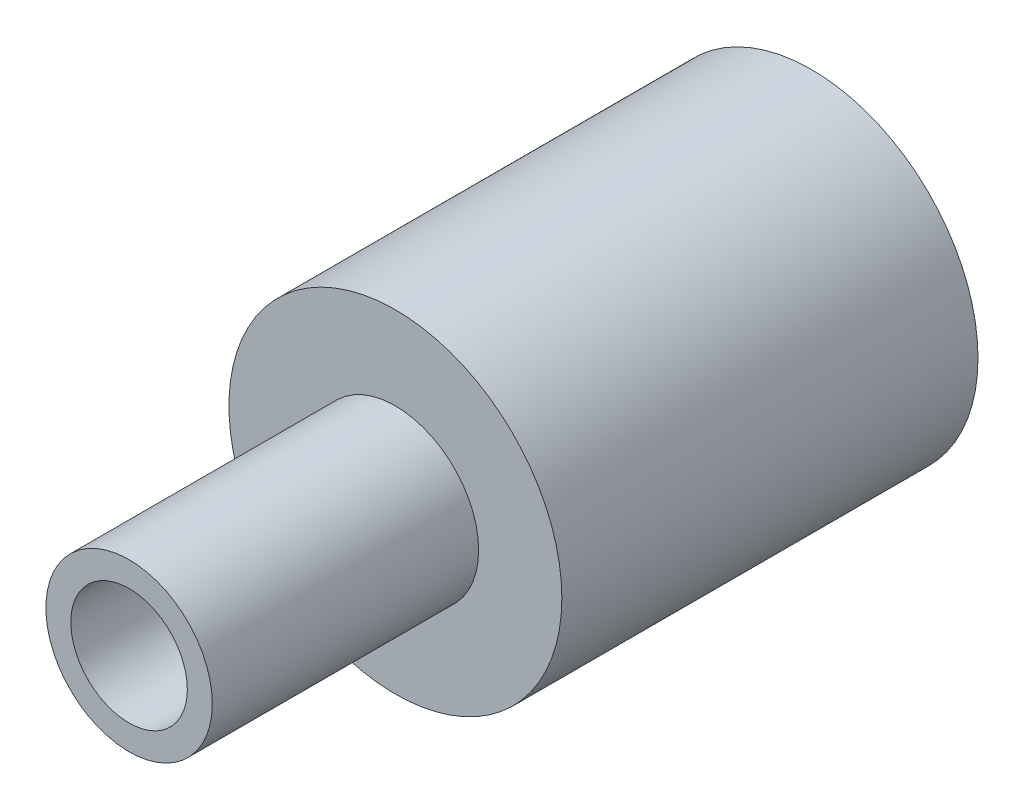
from build123d import *

# Parameters (mm, degrees)
SKETCH1_R           = 10
BOSS_EXTRUDE1_DEPTH = 41
SKETCH2_R           = 5
CUT_EXTRUDE1_DEPTH  = 10
SKETCH3_OUTSIDE_W   = 31.962
SKETCH3_OUTSIDE_H   = 31.962
SKETCH3_OUTSIDE_R   = 5
CUT_EXTRUDE2_DEPTH  = 16
SKETCH4_R           = 3.5
CUT_EXTRUDE3_DEPTH  = 12


with BuildPart() as part:
    # Sketch1 → Boss-Extrude1 (new body)
    with BuildSketch(Plane.XY):
        Circle(SKETCH1_R)
    extrude(amount=BOSS_EXTRUDE1_DEPTH)

    # Sketch2 → Cut-Extrude1 (cut)
    with BuildSketch(Plane(origin=(0, 0, 0), x_dir=(-1, 0, 0), z_dir=(0, 0, -1))):
        Circle(SKETCH2_R)
    extrude(amount=-CUT_EXTRUDE1_DEPTH, mode=Mode.SUBTRACT)

    # Sketch3 outside → Cut-Extrude2 (cut)
    with BuildSketch(Plane.XY.offset(41)):
        Rectangle(SKETCH3_OUTSIDE_W, SKETCH3_OUTSIDE_H)
        with Locations(Location((0, 0, 0), (0, 0, 180))):
            Circle(SKETCH3_OUTSIDE_R, mode=Mode.SUBTRACT)
    extrude(amount=-CUT_EXTRUDE2_DEPTH, mode=Mode.SUBTRACT)

    # Sketch4 → Cut-Extrude3 (cut)
    with BuildSketch(Plane.XY.offset(41)):
        Circle(SKETCH4_R)
    extrude(amount=-CUT_EXTRUDE3_DEPTH, mode=Mode.SUBTRACT)


solid = part.part
